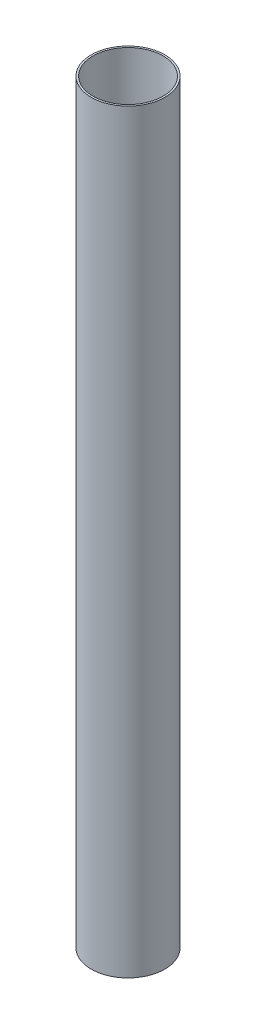
from build123d import *

# Parameters (mm, degrees)
SKETCH1_R           = 40
SKETCH1_R_2         = 38
BOSS_EXTRUDE1_DEPTH = 820


with BuildPart() as part:
    # Sketch1 → Boss-Extrude1 (new body)
    with BuildSketch(Plane(origin=(0, 0, 0), x_dir=(1, 0, 0), z_dir=(0, 1, 0))):
        with Locations(Location((0, 0, 0), (0, 0, 90))):
            Circle(SKETCH1_R)
        with Locations(Location((0, 0, 0), (0, 0, 90))):
            Circle(SKETCH1_R_2, mode=Mode.SUBTRACT)
    extrude(amount=BOSS_EXTRUDE1_DEPTH)


solid = part.part
